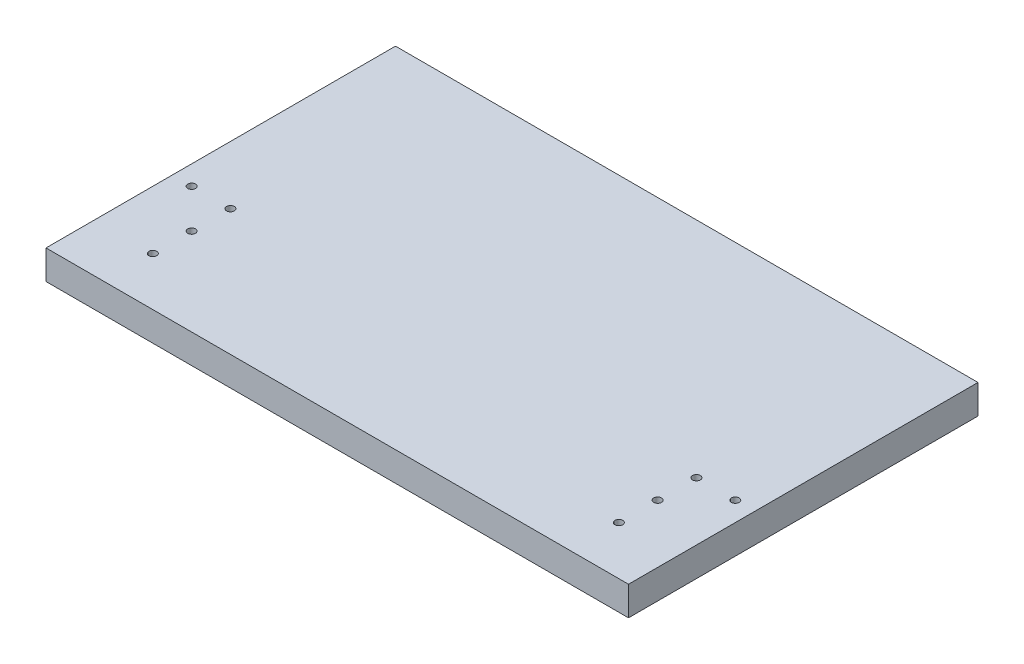
from build123d import *

# Parameters (mm, degrees)
CROQUIS1_W              = 300
CROQUIS1_H              = 180
SALIENTE_EXTRUIR1_DEPTH = 15
CROQUIS2_R              = 2
CORTAR_EXTRUIR1_DEPTH   = 10


with BuildPart() as part:
    # Croquis1 → Saliente-Extruir1 (new body)
    with BuildSketch(Plane(origin=(0, 0, 0), x_dir=(1, 0, 0), z_dir=(0, 1, 0))):
        Rectangle(CROQUIS1_W, CROQUIS1_H)
    extrude(amount=SALIENTE_EXTRUIR1_DEPTH)

    # Croquis2 → Cortar-Extruir1 (cut)
    with BuildSketch(Plane(origin=(0, 15, 0), x_dir=(1, 0, 0), z_dir=(0, 1, 0))):
        with Locations(Location((-120, -65, 0), (0, 0, 270))):
            Circle(CROQUIS2_R)
        with Locations(Location((-120, -45, 0), (0, 0, 270))):
            Circle(CROQUIS2_R)
        with Locations(Location((120, -65, 0), (0, 0, 270))):
            Circle(CROQUIS2_R)
        with Locations(Location((120, -45, 0), (0, 0, 270))):
            Circle(CROQUIS2_R)
        with Locations(Location((-140, -25, 0), (0, 0, 270))):
            Circle(CROQUIS2_R)
        with Locations(Location((-120, -25, 0), (0, 0, 270))):
            Circle(CROQUIS2_R)
        with Locations(Location((120, -25, 0), (0, 0, 270))):
            Circle(CROQUIS2_R)
        with Locations(Location((140, -25, 0), (0, 0, 270))):
            Circle(CROQUIS2_R)
    extrude(amount=-CORTAR_EXTRUIR1_DEPTH, mode=Mode.SUBTRACT)


solid = part.part
